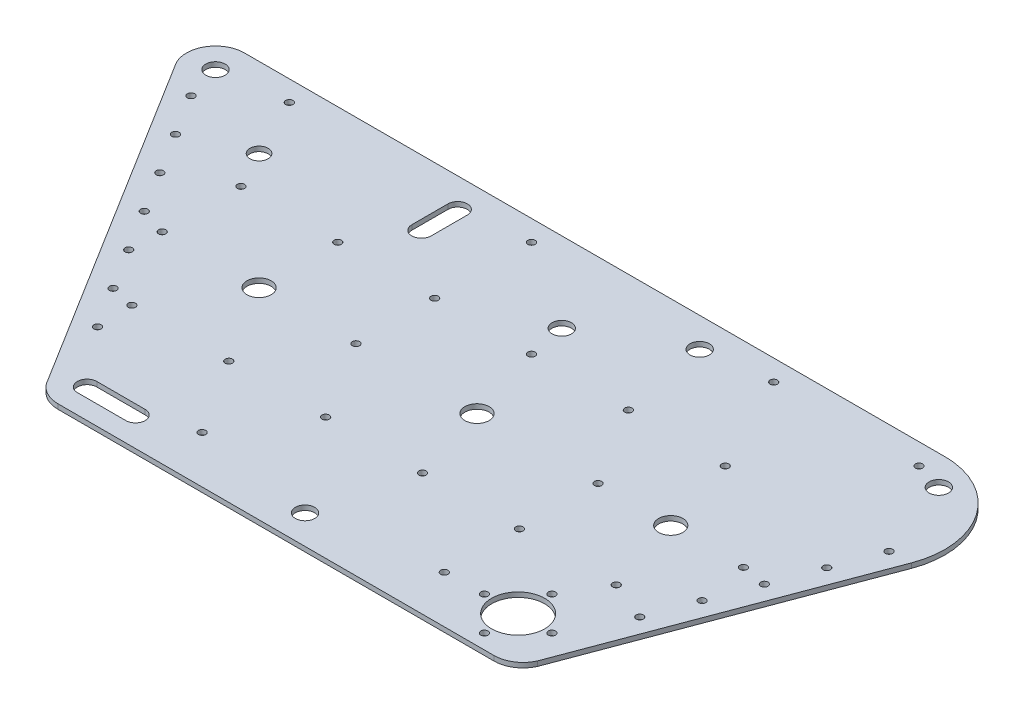
from build123d import *

# Parameters (mm, degrees)
SKETCH1_R           = 11
BOSS_EXTRUDE1_DEPTH = 2


with BuildPart() as part:
    # Sketch1 → Boss-Extrude1 (new body)
    with BuildSketch(Plane(origin=(0, 0, 0), x_dir=(1, 0, 0), z_dir=(0, 1, 0))):
        with BuildLine():
            Line((183.7351236, 145.811484683), (-106.453329342, 145.556353314))
            add(Edge.make_bspline(
                [(-106.453329342, 145.556353314), (-128.218778294, 145.537217306), (-116.57620641, 127.146473023)],
                knots=[0.000879148, 0.000879148, 0.000879148, 2.135198153, 2.135198153, 2.135198153], degree=2, weights=[1, 0.482613975, 1]))
            Line((-116.57620641, 127.146473023), (-29.827493923, -12.478104824))
            add(Edge.make_bspline(
                [(-29.827493923, -12.478104824), (-26.480988601, -19.080321205), (-19.079367145, -19.080321188)],
                knots=[2.039949792, 2.039949792, 2.039949792, 3.141592656, 3.141592656, 3.141592656], degree=2, weights=[1, 0.852094883, 1]))
            Line((-19.079367145, -19.080321188), (161.672532352, -19.080321188))
            add(Edge.make_bspline(
                [(161.672532352, -19.080321188), (169.404965437, -19.080321188), (172.626812554, -12.050729165)],
                knots=[0, 0, 0, 1.141020896, 1.141020896, 1.141020896], degree=2, weights=[1, 0.841625411, 1]))
            Line((172.626812554, -12.050729165), (214.973993339, 100.756401394))
            add(Edge.make_bspline(
                [(214.973993339, 100.756401394), (231.90255028, 145.851774862), (183.736548045, 145.811485911)],
                knots=[4.353256006, 4.353256006, 4.353256006, 6.284014289, 6.284014289, 6.284014289], degree=2, weights=[1, 0.569095733, 0.999977608]))
            Line((183.736548045, 145.811485935), (183.7351236, 145.811484683))
        make_face()
        with BuildLine():
            add(Edge.make_bspline(
                [(-38.524092784, 15.23540212), (-35.915163838, 15.23540212), (-37.219628311, 17.49491384), (-38.524092784, 19.754425559), (-39.828557257, 17.49491384), (-41.13302173, 15.23540212), (-38.524092784, 15.23540212)],
                knots=[0, 0, 0, 2.094395102, 2.094395102, 4.188790205, 4.188790205, 6.283185307, 6.283185307, 6.283185307], degree=2, weights=[1, 0.5, 1, 0.5, 1, 0.5, 1]))
        make_face(mode=Mode.SUBTRACT)
        with BuildLine():
            add(Edge.make_bspline(
                [(-19.079367172, -3.012682293), (-23.09607605, -3.012682293), (-23.09607605, -7.029592017), (-23.09607605, -11.04650174), (-19.079367172, -11.04650174)],
                knots=[3.141592654, 3.141592654, 3.141592654, 4.71238898, 4.71238898, 6.283185307, 6.283185307, 6.283185307], degree=2, weights=[1, 0.707106781, 1, 0.707106781, 1]))
            Line((-19.079367172, -3.012682293), (1.00417722, -3.012682293))
            add(Edge.make_bspline(
                [(1.00417722, -11.04650174), (5.020886098, -11.04650174), (5.020886098, -7.029592017), (5.020886098, -3.012682293), (1.00417722, -3.012682293)],
                knots=[3.141592654, 3.141592654, 3.141592654, 4.71238898, 4.71238898, 6.283185307, 6.283185307, 6.283185307], degree=2, weights=[1, 0.707106781, 1, 0.707106781, 1]))
            Line((1.00417722, -11.04650174), (-19.079367172, -11.04650174))
        make_face(mode=Mode.SUBTRACT)
        with BuildLine():
            add(Edge.make_bspline(
                [(21.087721611, 2.008454862), (18.478792665, 2.008454862), (19.783257138, -0.251056858), (21.087721611, -2.510568577), (22.392186084, -0.251056858), (23.696650557, 2.008454862), (21.087721611, 2.008454862)],
                knots=[0, 0, 0, 2.094395102, 2.094395102, 4.188790205, 4.188790205, 6.283185307, 6.283185307, 6.283185307], degree=2, weights=[1, 0.5, 1, 0.5, 1, 0.5, 1]))
        make_face(mode=Mode.SUBTRACT)
        with BuildLine():
            add(Edge.make_bspline(
                [(-39.162911564, 33.139499508), (-41.77184051, 33.139499508), (-40.467376037, 30.879987789), (-39.162911564, 28.620476069), (-37.85844709, 30.879987789), (-36.553982617, 33.139499508), (-39.162911564, 33.139499508)],
                knots=[0, 0, 0, 2.094395102, 2.094395102, 4.188790205, 4.188790205, 6.283185307, 6.283185307, 6.283185307], degree=2, weights=[1, 0.5, 1, 0.5, 1, 0.5, 1]))
        make_face(mode=Mode.SUBTRACT)
        with BuildLine():
            add(Edge.make_bspline(
                [(-49.123052052, 35.307417871), (-51.731980998, 35.307417871), (-50.427516525, 33.047906151), (-49.123052052, 30.788394432), (-47.818587579, 33.047906151), (-46.514123106, 35.307417871), (-49.123052052, 35.307417871)],
                knots=[0, 0, 0, 2.094395102, 2.094395102, 4.188790205, 4.188790205, 6.283185307, 6.283185307, 6.283185307], degree=2, weights=[1, 0.5, 1, 0.5, 1, 0.5, 1]))
        make_face(mode=Mode.SUBTRACT)
        with BuildLine():
            add(Edge.make_bspline(
                [(-59.722171528, 49.354326897), (-57.113242582, 49.354326897), (-58.417707055, 51.613838617), (-59.722171528, 53.873350336), (-61.026636002, 51.613838617), (-62.331100475, 49.354326897), (-59.722171528, 49.354326897)],
                knots=[0, 0, 0, 2.094395102, 2.094395102, 4.188790205, 4.188790205, 6.283185307, 6.283185307, 6.283185307], degree=2, weights=[1, 0.5, 1, 0.5, 1, 0.5, 1]))
        make_face(mode=Mode.SUBTRACT)
        with BuildLine():
            add(Edge.make_bspline(
                [(1.00417722, 30.126815311), (3.613106166, 30.126815311), (2.308641693, 32.386327031), (1.00417722, 34.64583875), (-0.300287254, 32.386327031), (-1.604751727, 30.126815311), (1.00417722, 30.126815311)],
                knots=[0, 0, 0, 2.094395102, 2.094395102, 4.188790205, 4.188790205, 6.283185307, 6.283185307, 6.283185307], degree=2, weights=[1, 0.5, 1, 0.5, 1, 0.5, 1]))
        make_face(mode=Mode.SUBTRACT)
        with BuildLine():
            add(Edge.make_bspline(
                [(41.171266003, 33.139493795), (38.562337057, 33.139493795), (39.86680153, 30.879982076), (41.171266003, 28.620470356), (42.475730476, 30.879982076), (43.780194949, 33.139493795), (41.171266003, 33.139493795)],
                knots=[0, 0, 0, 2.094395102, 2.094395102, 4.188790205, 4.188790205, 6.283185307, 6.283185307, 6.283185307], degree=2, weights=[1, 0.5, 1, 0.5, 1, 0.5, 1]))
        make_face(mode=Mode.SUBTRACT)
        with BuildLine():
            add(Edge.make_bspline(
                [(71.29658259, -3.012682293), (64.339438734, -3.012682293), (67.818010662, -9.038046879), (71.29658259, -15.063411464), (74.775154518, -9.038046879), (78.253726447, -3.012682293), (71.29658259, -3.012682293)],
                knots=[0, 0, 0, 2.094395102, 2.094395102, 4.188790205, 4.188790205, 6.283185307, 6.283185307, 6.283185307], degree=2, weights=[1, 0.5, 1, 0.5, 1, 0.5, 1]))
        make_face(mode=Mode.SUBTRACT)
        with BuildLine():
            add(Edge.make_bspline(
                [(121.505443569, 2.008454862), (118.896514623, 2.008454862), (120.200979096, -0.251056858), (121.505443569, -2.510568577), (122.809908042, -0.251056858), (124.114372515, 2.008454862), (121.505443569, 2.008454862)],
                knots=[0, 0, 0, 2.094395102, 2.094395102, 4.188790205, 4.188790205, 6.283185307, 6.283185307, 6.283185307], degree=2, weights=[1, 0.5, 1, 0.5, 1, 0.5, 1]))
        make_face(mode=Mode.SUBTRACT)
        with BuildLine():
            add(Edge.make_bspline(
                [(137.630760156, 2.498433276), (135.02183121, 2.498433276), (136.326295683, 0.238921557), (137.630760156, -2.020590163), (138.935224629, 0.238921557), (140.239689103, 2.498433276), (137.630760156, 2.498433276)],
                knots=[0, 0, 0, 2.094395102, 2.094395102, 4.188790205, 4.188790205, 6.283185307, 6.283185307, 6.283185307], degree=2, weights=[1, 0.5, 1, 0.5, 1, 0.5, 1]))
        make_face(mode=Mode.SUBTRACT)
        with BuildLine():
            add(Edge.make_bspline(
                [(151.630760156, -11.501566724), (149.02183121, -11.501566724), (150.326295683, -13.761078443), (151.630760156, -16.020590163), (152.935224629, -13.761078443), (154.239689103, -11.501566724), (151.630760156, -11.501566724)],
                knots=[0, 0, 0, 2.094395102, 2.094395102, 4.188790205, 4.188790205, 6.283185307, 6.283185307, 6.283185307], degree=2, weights=[1, 0.5, 1, 0.5, 1, 0.5, 1]))
        make_face(mode=Mode.SUBTRACT)
        with Locations(Location((151.630760156, 0.99209213, 0), (0, 0, 270))):
            Circle(SKETCH1_R, mode=Mode.SUBTRACT)
        with BuildLine():
            add(Edge.make_bspline(
                [(165.630760156, 2.498433276), (163.02183121, 2.498433276), (164.326295683, 0.238921557), (165.630760156, -2.020590163), (166.935224629, 0.238921557), (168.239689103, 2.498433276), (165.630760156, 2.498433276)],
                knots=[0, 0, 0, 2.094395102, 2.094395102, 4.188790205, 4.188790205, 6.283185307, 6.283185307, 6.283185307], degree=2, weights=[1, 0.5, 1, 0.5, 1, 0.5, 1]))
        make_face(mode=Mode.SUBTRACT)
        with BuildLine():
            add(Edge.make_bspline(
                [(151.630760156, 16.498433276), (149.02183121, 16.498433276), (150.326295683, 14.238921557), (151.630760156, 11.979409837), (152.935224629, 14.238921557), (154.239689103, 16.498433276), (151.630760156, 16.498433276)],
                knots=[0, 0, 0, 2.094395102, 2.094395102, 4.188790205, 4.188790205, 6.283185307, 6.283185307, 6.283185307], degree=2, weights=[1, 0.5, 1, 0.5, 1, 0.5, 1]))
        make_face(mode=Mode.SUBTRACT)
        with BuildLine():
            add(Edge.make_bspline(
                [(81.338354786, 33.139490939), (78.72942584, 33.139490939), (80.033890313, 30.879979219), (81.338354786, 28.620467499), (82.642819259, 30.879979219), (83.947283732, 33.139490939), (81.338354786, 33.139490939)],
                knots=[0, 0, 0, 2.094395102, 2.094395102, 4.188790205, 4.188790205, 6.283185307, 6.283185307, 6.283185307], degree=2, weights=[1, 0.5, 1, 0.5, 1, 0.5, 1]))
        make_face(mode=Mode.SUBTRACT)
        with BuildLine():
            add(Edge.make_bspline(
                [(121.505443569, 30.126803885), (124.114372515, 30.126803885), (122.809908042, 32.386315605), (121.505443569, 34.645827324), (120.200979096, 32.386315605), (118.896514623, 30.126803885), (121.505443569, 30.126803885)],
                knots=[0, 0, 0, 2.094395102, 2.094395102, 4.188790205, 4.188790205, 6.283185307, 6.283185307, 6.283185307], degree=2, weights=[1, 0.5, 1, 0.5, 1, 0.5, 1]))
        make_face(mode=Mode.SUBTRACT)
        with BuildLine():
            add(Edge.make_bspline(
                [(161.672532352, 33.139483321), (159.063603406, 33.139483321), (160.368067879, 30.879971602), (161.672532352, 28.620459882), (162.976996825, 30.879971602), (164.281461298, 33.139483321), (161.672532352, 33.139483321)],
                knots=[0, 0, 0, 2.094395102, 2.094395102, 4.188790205, 4.188790205, 6.283185307, 6.283185307, 6.283185307], degree=2, weights=[1, 0.5, 1, 0.5, 1, 0.5, 1]))
        make_face(mode=Mode.SUBTRACT)
        with BuildLine():
            add(Edge.make_bspline(
                [(178.080325514, 26.465868242), (175.471396568, 26.465868242), (176.775861041, 24.206356522), (178.080325514, 21.946844803), (179.384789987, 24.206356522), (180.68925446, 26.465868242), (178.080325514, 26.465868242)],
                knots=[0, 0, 0, 2.094395102, 2.094395102, 4.188790205, 4.188790205, 6.283185307, 6.283185307, 6.283185307], degree=2, weights=[1, 0.5, 1, 0.5, 1, 0.5, 1]))
        make_face(mode=Mode.SUBTRACT)
        with BuildLine():
            add(Edge.make_bspline(
                [(185.107793634, 42.267531435), (187.71672258, 42.267531435), (186.412258107, 44.527043155), (185.107793634, 46.786554875), (183.803329161, 44.527043155), (182.498864688, 42.267531435), (185.107793634, 42.267531435)],
                knots=[0, 0, 0, 2.094395102, 2.094395102, 4.188790205, 4.188790205, 6.283185307, 6.283185307, 6.283185307], degree=2, weights=[1, 0.5, 1, 0.5, 1, 0.5, 1]))
        make_face(mode=Mode.SUBTRACT)
        with BuildLine():
            add(Edge.make_bspline(
                [(192.135287121, 64.09462713), (189.526358175, 64.09462713), (190.830822648, 61.83511541), (192.135287121, 59.575603691), (193.439751595, 61.83511541), (194.744216068, 64.09462713), (192.135287121, 64.09462713)],
                knots=[0, 0, 0, 2.094395102, 2.094395102, 4.188790205, 4.188790205, 6.283185307, 6.283185307, 6.283185307], degree=2, weights=[1, 0.5, 1, 0.5, 1, 0.5, 1]))
        make_face(mode=Mode.SUBTRACT)
        with BuildLine():
            add(Edge.make_bspline(
                [(-70.321501695, 66.414257328), (-67.712572749, 66.414257328), (-69.017037222, 68.673769047), (-70.321501695, 70.933280767), (-71.625966168, 68.673769047), (-72.930430641, 66.414257328), (-70.321501695, 66.414257328)],
                knots=[0, 0, 0, 2.094395102, 2.094395102, 4.188790205, 4.188790205, 6.283185307, 6.283185307, 6.283185307], degree=2, weights=[1, 0.5, 1, 0.5, 1, 0.5, 1]))
        make_face(mode=Mode.SUBTRACT)
        with BuildLine():
            add(Edge.make_bspline(
                [(-59.246455955, 65.776896727), (-61.855384901, 65.776896727), (-60.550920428, 63.517385008), (-59.246455955, 61.257873288), (-57.941991482, 63.517385008), (-56.637527009, 65.776896727), (-59.246455955, 65.776896727)],
                knots=[0, 0, 0, 2.094395102, 2.094395102, 4.188790205, 4.188790205, 6.283185307, 6.283185307, 6.283185307], degree=2, weights=[1, 0.5, 1, 0.5, 1, 0.5, 1]))
        make_face(mode=Mode.SUBTRACT)
        with BuildLine():
            add(Edge.make_bspline(
                [(-91.519971104, 100.533810891), (-88.911042158, 100.533810891), (-90.215506631, 102.79332261), (-91.519971104, 105.05283433), (-92.824435577, 102.79332261), (-94.12890005, 100.533810891), (-91.519971104, 100.533810891)],
                knots=[0, 0, 0, 2.094395102, 2.094395102, 4.188790205, 4.188790205, 6.283185307, 6.283185307, 6.283185307], degree=2, weights=[1, 0.5, 1, 0.5, 1, 0.5, 1]))
        make_face(mode=Mode.SUBTRACT)
        with BuildLine():
            add(Edge.make_bspline(
                [(-80.920930679, 83.474346807), (-78.312001733, 83.474346807), (-79.616466206, 85.733858527), (-80.920930679, 87.993370247), (-82.225395152, 85.733858527), (-83.529859625, 83.474346807), (-80.920930679, 83.474346807)],
                knots=[0, 0, 0, 2.094395102, 2.094395102, 4.188790205, 4.188790205, 6.283185307, 6.283185307, 6.283185307], degree=2, weights=[1, 0.5, 1, 0.5, 1, 0.5, 1]))
        make_face(mode=Mode.SUBTRACT)
        with BuildLine():
            add(Edge.make_bspline(
                [(-59.246455955, 98.414288233), (-61.855384901, 98.414288233), (-60.550920428, 96.154776513), (-59.246455955, 93.895264794), (-57.941991482, 96.154776513), (-56.637527009, 98.414288233), (-59.246455955, 98.414288233)],
                knots=[0, 0, 0, 2.094395102, 2.094395102, 4.188790205, 4.188790205, 6.283185307, 6.283185307, 6.283185307], degree=2, weights=[1, 0.5, 1, 0.5, 1, 0.5, 1]))
        make_face(mode=Mode.SUBTRACT)
        with BuildLine():
            add(Edge.make_bspline(
                [(-19.079367172, 69.291692736), (-27.775796993, 69.291692736), (-23.427582082, 61.759987003), (-19.079367172, 54.228281271), (-14.731152262, 61.759987003), (-10.382937351, 69.291692736), (-19.079367172, 69.291692736)],
                knots=[0, 0, 0, 2.094395102, 2.094395102, 4.188790205, 4.188790205, 6.283185307, 6.283185307, 6.283185307], degree=2, weights=[1, 0.5, 1, 0.5, 1, 0.5, 1]))
        make_face(mode=Mode.SUBTRACT)
        with BuildLine():
            add(Edge.make_bspline(
                [(21.087721611, 65.776896727), (18.478792665, 65.776896727), (19.783257138, 63.517385008), (21.087721611, 61.257873288), (22.392186084, 63.517385008), (23.696650557, 65.776896727), (21.087721611, 65.776896727)],
                knots=[0, 0, 0, 2.094395102, 2.094395102, 4.188790205, 4.188790205, 6.283185307, 6.283185307, 6.283185307], degree=2, weights=[1, 0.5, 1, 0.5, 1, 0.5, 1]))
        make_face(mode=Mode.SUBTRACT)
        with BuildLine():
            add(Edge.make_bspline(
                [(-19.079367172, 98.414288233), (-21.688296118, 98.414288233), (-20.383831645, 96.154776513), (-19.079367172, 93.895264794), (-17.774902699, 96.154776513), (-16.470438226, 98.414288233), (-19.079367172, 98.414288233)],
                knots=[0, 0, 0, 2.094395102, 2.094395102, 4.188790205, 4.188790205, 6.283185307, 6.283185307, 6.283185307], degree=2, weights=[1, 0.5, 1, 0.5, 1, 0.5, 1]))
        make_face(mode=Mode.SUBTRACT)
        with BuildLine():
            add(Edge.make_bspline(
                [(21.087721611, 98.414288233), (18.478792665, 98.414288233), (19.783257138, 96.154776513), (21.087721611, 93.895264794), (22.392186084, 96.154776513), (23.696650557, 98.414288233), (21.087721611, 98.414288233)],
                knots=[0, 0, 0, 2.094395102, 2.094395102, 4.188790205, 4.188790205, 6.283185307, 6.283185307, 6.283185307], degree=2, weights=[1, 0.5, 1, 0.5, 1, 0.5, 1]))
        make_face(mode=Mode.SUBTRACT)
        with BuildLine():
            add(Edge.make_bspline(
                [(-102.119093111, 120.606088576), (-104.728022057, 120.606088576), (-103.423557584, 118.346576857), (-102.119093111, 116.087065137), (-100.814628638, 118.346576857), (-99.510164165, 120.606088576), (-102.119093111, 120.606088576)],
                knots=[0, 0, 0, 2.094395102, 2.094395102, 4.188790205, 4.188790205, 6.283185307, 6.283185307, 6.283185307], degree=2, weights=[1, 0.5, 1, 0.5, 1, 0.5, 1]))
        make_face(mode=Mode.SUBTRACT)
        with BuildLine():
            add(Edge.make_bspline(
                [(-67.279873712, 108.7076194), (-60.757551346, 108.7076194), (-64.018712529, 114.356398699), (-67.279873712, 120.005177999), (-70.541034894, 114.356398699), (-73.802196077, 108.7076194), (-67.279873712, 108.7076194)],
                knots=[0, 0, 0, 2.094395102, 2.094395102, 4.188790205, 4.188790205, 6.283185307, 6.283185307, 6.283185307], degree=2, weights=[1, 0.5, 1, 0.5, 1, 0.5, 1]))
        make_face(mode=Mode.SUBTRACT)
        with BuildLine():
            add(Edge.make_bspline(
                [(-106.442785275, 129.545338593), (-99.485641419, 129.545338593), (-102.964213347, 135.570703178), (-106.442785275, 141.596067764), (-109.921357204, 135.570703178), (-113.399929132, 129.545338593), (-106.442785275, 129.545338593)],
                knots=[0, 0, 0, 2.094395102, 2.094395102, 4.188790205, 4.188790205, 6.283185307, 6.283185307, 6.283185307], degree=2, weights=[1, 0.5, 1, 0.5, 1, 0.5, 1]))
        make_face(mode=Mode.SUBTRACT)
        with BuildLine():
            add(Edge.make_bspline(
                [(-79.329990437, 138.583385471), (-81.938919383, 138.583385471), (-80.63445491, 136.323873752), (-79.329990437, 134.064362032), (-78.025525964, 136.323873752), (-76.721061491, 138.583385471), (-79.329990437, 138.583385471)],
                knots=[0, 0, 0, 2.094395102, 2.094395102, 4.188790205, 4.188790205, 6.283185307, 6.283185307, 6.283185307], degree=2, weights=[1, 0.5, 1, 0.5, 1, 0.5, 1]))
        make_face(mode=Mode.SUBTRACT)
        with BuildLine():
            add(Edge.make_bspline(
                [(-2.008354439, 133.562248316), (-2.008354439, 137.57915804), (-6.025063317, 137.57915804), (-10.041772196, 137.57915804), (-10.041772196, 133.562248316)],
                knots=[1.570796327, 1.570796327, 1.570796327, 3.141592654, 3.141592654, 4.71238898, 4.71238898, 4.71238898], degree=2, weights=[1, 0.707106781, 1, 0.707106781, 1]))
            Line((-2.008354439, 133.562248316), (-2.008354439, 118.562248316))
            add(Edge.make_bspline(
                [(-10.041772196, 118.562248316), (-10.041772196, 114.545338593), (-6.025063317, 114.545338593), (-2.008354439, 114.545338593), (-2.008354439, 118.562248316)],
                knots=[1.570796327, 1.570796327, 1.570796327, 3.141592654, 3.141592654, 4.71238898, 4.71238898, 4.71238898], degree=2, weights=[1, 0.707106781, 1, 0.707106781, 1]))
            Line((-10.041772196, 118.562248316), (-10.041772196, 133.562248316))
        make_face(mode=Mode.SUBTRACT)
        with BuildLine():
            add(Edge.make_bspline(
                [(21.087721611, 138.583385471), (18.478792665, 138.583385471), (19.783257138, 136.323873752), (21.087721611, 134.064362032), (22.392186084, 136.323873752), (23.696650557, 138.583385471), (21.087721611, 138.583385471)],
                knots=[0, 0, 0, 2.094395102, 2.094395102, 4.188790205, 4.188790205, 6.283185307, 6.283185307, 6.283185307], degree=2, weights=[1, 0.5, 1, 0.5, 1, 0.5, 1]))
        make_face(mode=Mode.SUBTRACT)
        with BuildLine():
            add(Edge.make_bspline(
                [(71.29658259, 69.291692736), (62.60015277, 69.291692736), (66.94836768, 61.759987003), (71.29658259, 54.228281271), (75.6447975, 61.759987003), (79.993012411, 69.291692736), (71.29658259, 69.291692736)],
                knots=[0, 0, 0, 2.094395102, 2.094395102, 4.188790205, 4.188790205, 6.283185307, 6.283185307, 6.283185307], degree=2, weights=[1, 0.5, 1, 0.5, 1, 0.5, 1]))
        make_face(mode=Mode.SUBTRACT)
        with BuildLine():
            add(Edge.make_bspline(
                [(121.505443569, 65.776896727), (118.896514623, 65.776896727), (120.200979096, 63.517385008), (121.505443569, 61.257873288), (122.809908042, 63.517385008), (124.114372515, 65.776896727), (121.505443569, 65.776896727)],
                knots=[0, 0, 0, 2.094395102, 2.094395102, 4.188790205, 4.188790205, 6.283185307, 6.283185307, 6.283185307], degree=2, weights=[1, 0.5, 1, 0.5, 1, 0.5, 1]))
        make_face(mode=Mode.SUBTRACT)
        with BuildLine():
            add(Edge.make_bspline(
                [(61.254810394, 98.414288233), (58.645881448, 98.414288233), (59.950345921, 96.154776513), (61.254810394, 93.895264794), (62.559274867, 96.154776513), (63.86373934, 98.414288233), (61.254810394, 98.414288233)],
                knots=[0, 0, 0, 2.094395102, 2.094395102, 4.188790205, 4.188790205, 6.283185307, 6.283185307, 6.283185307], degree=2, weights=[1, 0.5, 1, 0.5, 1, 0.5, 1]))
        make_face(mode=Mode.SUBTRACT)
        with BuildLine():
            add(Edge.make_bspline(
                [(101.421899177, 98.414288233), (98.812970231, 98.414288233), (100.117434704, 96.154776513), (101.421899177, 93.895264794), (102.726363651, 96.154776513), (104.030828124, 98.414288233), (101.421899177, 98.414288233)],
                knots=[0, 0, 0, 2.094395102, 2.094395102, 4.188790205, 4.188790205, 6.283185307, 6.283185307, 6.283185307], degree=2, weights=[1, 0.5, 1, 0.5, 1, 0.5, 1]))
        make_face(mode=Mode.SUBTRACT)
        with BuildLine():
            add(Edge.make_bspline(
                [(141.588987961, 98.414288233), (138.980059014, 98.414288233), (140.284523488, 96.154776513), (141.588987961, 93.895264794), (142.893452434, 96.154776513), (144.197916907, 98.414288233), (141.588987961, 98.414288233)],
                knots=[0, 0, 0, 2.094395102, 2.094395102, 4.188790205, 4.188790205, 6.283185307, 6.283185307, 6.283185307], degree=2, weights=[1, 0.5, 1, 0.5, 1, 0.5, 1]))
        make_face(mode=Mode.SUBTRACT)
        with BuildLine():
            add(Edge.make_bspline(
                [(151.630760156, 69.291692736), (142.934330336, 69.291692736), (147.282545246, 61.759987003), (151.630760156, 54.228281271), (155.978975067, 61.759987003), (160.327189977, 69.291692736), (151.630760156, 69.291692736)],
                knots=[0, 0, 0, 2.094395102, 2.094395102, 4.188790205, 4.188790205, 6.283185307, 6.283185307, 6.283185307], degree=2, weights=[1, 0.5, 1, 0.5, 1, 0.5, 1]))
        make_face(mode=Mode.SUBTRACT)
        with BuildLine():
            add(Edge.make_bspline(
                [(181.756076744, 65.776896727), (179.147147798, 65.776896727), (180.451612271, 63.517385008), (181.756076744, 61.257873288), (183.060541217, 63.517385008), (184.36500569, 65.776896727), (181.756076744, 65.776896727)],
                knots=[0, 0, 0, 2.094395102, 2.094395102, 4.188790205, 4.188790205, 6.283185307, 6.283185307, 6.283185307], degree=2, weights=[1, 0.5, 1, 0.5, 1, 0.5, 1]))
        make_face(mode=Mode.SUBTRACT)
        with BuildLine():
            add(Edge.make_bspline(
                [(199.162844353, 79.896528897), (201.771773299, 79.896528897), (200.467308826, 82.156040617), (199.162844353, 84.415552336), (197.85837988, 82.156040617), (196.553915406, 79.896528897), (199.162844353, 79.896528897)],
                knots=[0, 0, 0, 2.094395102, 2.094395102, 4.188790205, 4.188790205, 6.283185307, 6.283185307, 6.283185307], degree=2, weights=[1, 0.5, 1, 0.5, 1, 0.5, 1]))
        make_face(mode=Mode.SUBTRACT)
        with BuildLine():
            add(Edge.make_bspline(
                [(206.190467733, 101.723972348), (203.581538787, 101.723972348), (204.88600326, 99.464460629), (206.190467733, 97.204948909), (207.494932206, 99.464460629), (208.799396679, 101.723972348), (206.190467733, 101.723972348)],
                knots=[0, 0, 0, 2.094395102, 2.094395102, 4.188790205, 4.188790205, 6.283185307, 6.283185307, 6.283185307], degree=2, weights=[1, 0.5, 1, 0.5, 1, 0.5, 1]))
        make_face(mode=Mode.SUBTRACT)
        with BuildLine():
            add(Edge.make_bspline(
                [(58.242278736, 116.49038199), (51.285134879, 116.49038199), (54.763706807, 110.465017405), (58.242278736, 104.439652819), (61.720850664, 110.465017405), (65.199422592, 116.49038199), (58.242278736, 116.49038199)],
                knots=[0, 0, 0, 2.094395102, 2.094395102, 4.188790205, 4.188790205, 6.283185307, 6.283185307, 6.283185307], degree=2, weights=[1, 0.5, 1, 0.5, 1, 0.5, 1]))
        make_face(mode=Mode.SUBTRACT)
        with BuildLine():
            add(Edge.make_bspline(
                [(90.375870236, 133.562248316), (90.281366753, 126.605398435), (96.353664977, 130.001977728), (102.425963201, 133.398557022), (96.44816846, 136.95882761), (90.47037372, 140.519098198), (90.375870236, 133.562248316)],
                knots=[0, 0, 0, 2.094395102, 2.094395102, 4.188790205, 4.188790205, 6.283185307, 6.283185307, 6.283185307], degree=2, weights=[1, 0.5, 1, 0.5, 1, 0.5, 1]))
        make_face(mode=Mode.SUBTRACT)
        with BuildLine():
            add(Edge.make_bspline(
                [(121.505443569, 138.583385471), (118.896514623, 138.583385471), (120.200979096, 136.323873752), (121.505443569, 134.064362032), (122.809908042, 136.323873752), (124.114372515, 138.583385471), (121.505443569, 138.583385471)],
                knots=[0, 0, 0, 2.094395102, 2.094395102, 4.188790205, 4.188790205, 6.283185307, 6.283185307, 6.283185307], degree=2, weights=[1, 0.5, 1, 0.5, 1, 0.5, 1]))
        make_face(mode=Mode.SUBTRACT)
        with BuildLine():
            add(Edge.make_bspline(
                [(181.756076744, 138.583385471), (179.147147798, 138.583385471), (180.451612271, 136.323873752), (181.756076744, 134.064362032), (183.060541217, 136.323873752), (184.36500569, 138.583385471), (181.756076744, 138.583385471)],
                knots=[0, 0, 0, 2.094395102, 2.094395102, 4.188790205, 4.188790205, 6.283185307, 6.283185307, 6.283185307], degree=2, weights=[1, 0.5, 1, 0.5, 1, 0.5, 1]))
        make_face(mode=Mode.SUBTRACT)
        with BuildLine():
            add(Edge.make_bspline(
                [(193.552265135, 137.524594275), (186.595121278, 137.524594275), (190.073693207, 131.49922969), (193.552265135, 125.473865104), (197.030837063, 131.49922969), (200.509408991, 137.524594275), (193.552265135, 137.524594275)],
                knots=[0, 0, 0, 2.094395102, 2.094395102, 4.188790205, 4.188790205, 6.283185307, 6.283185307, 6.283185307], degree=2, weights=[1, 0.5, 1, 0.5, 1, 0.5, 1]))
        make_face(mode=Mode.SUBTRACT)
    extrude(amount=BOSS_EXTRUDE1_DEPTH)


solid = part.part
